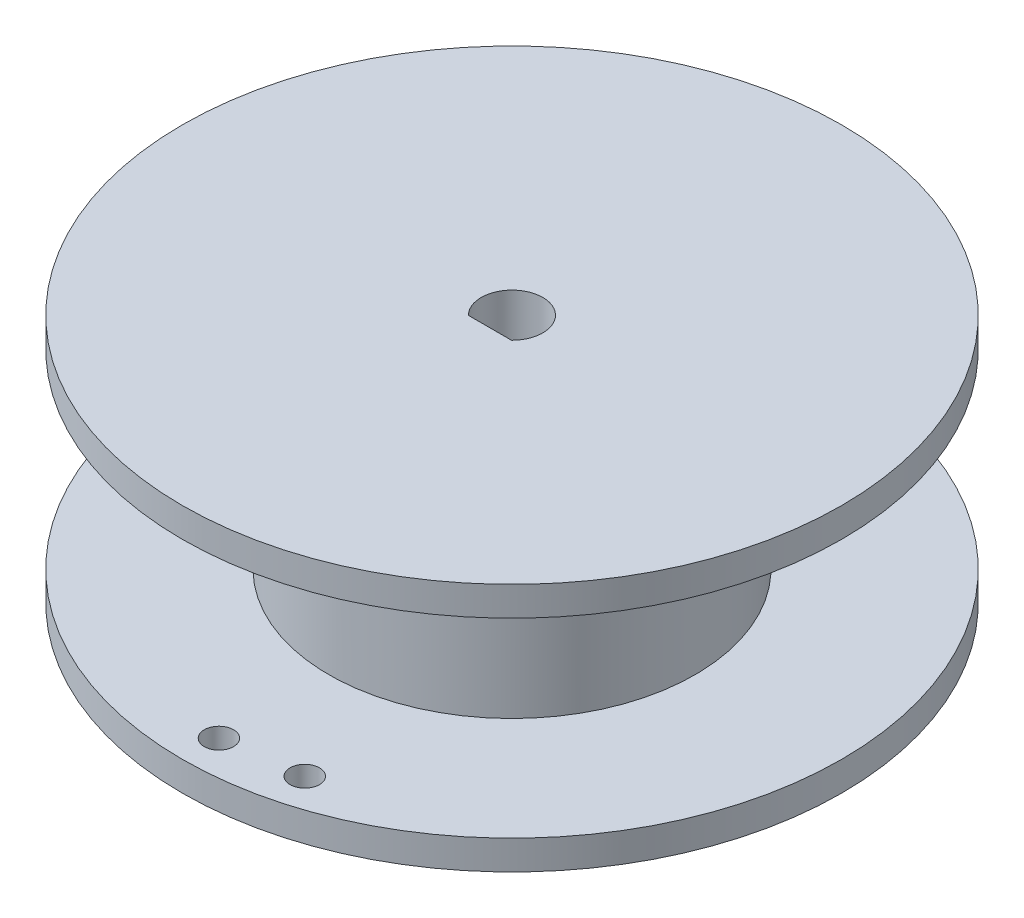
from build123d import *

# Parameters (mm, degrees)
SKETCH_1_R      = 12.5
EXTRUDE_1_DEPTH = 15
SKETCH_2_R      = 22.5
SKETCH_2_R_2    = 1
EXTRUDE_2_DEPTH = 2
SKETCH_3_R      = 22.5
EXTRUDE_3_DEPTH = 2


with BuildPart() as part:
    # 草图1 → 凸台-拉伸1 (new body)
    with BuildSketch(Plane(origin=(0, 0, 0), x_dir=(1, 0, 0), z_dir=(0, 1, 0))):
        with Locations(Location((0, 0, 0), (0, 0, 270))):
            Circle(SKETCH_1_R)
        with BuildLine():
            Line((-1.469693846, -1.5), (1.469693846, -1.5))
            ThreePointArc((1.469693846, -1.5), (0, 2.1), (-1.469693846, -1.5))
        make_face(mode=Mode.SUBTRACT)
    extrude(amount=EXTRUDE_1_DEPTH)

    # 草图2 → 凸台-拉伸2 (add)
    with BuildSketch(Plane.XZ):
        with Locations(Location((0, 0, 0), (0, 0, 270))):
            Circle(SKETCH_2_R)
        with Locations(Location((0, 20, 0), (0, 0, 270))):
            Circle(SKETCH_2_R_2, mode=Mode.SUBTRACT)
        with Locations(Location((5.176380902, 19.318516526, 0), (0, 0, 270))):
            Circle(SKETCH_2_R_2, mode=Mode.SUBTRACT)
        with BuildLine():
            Line((-1.469693846, 1.5), (1.469693846, 1.5))
            ThreePointArc((1.469693846, 1.5), (0, -2.1), (-1.469693846, 1.5))
        make_face(mode=Mode.SUBTRACT)
    extrude(amount=-EXTRUDE_2_DEPTH)

    # 草图3 → 凸台-拉伸3 (add)
    with BuildSketch(Plane(origin=(0, 15, 0), x_dir=(1, 0, 0), z_dir=(0, 1, 0))):
        with Locations(Location((0, 0, 0), (0, 0, 90))):
            Circle(SKETCH_3_R)
        with BuildLine():
            Line((-1.469693846, -1.5), (1.469693846, -1.5))
            ThreePointArc((1.469693846, -1.5), (0, 2.1), (-1.469693846, -1.5))
        make_face(mode=Mode.SUBTRACT)
    extrude(amount=EXTRUDE_3_DEPTH)


solid = part.part
